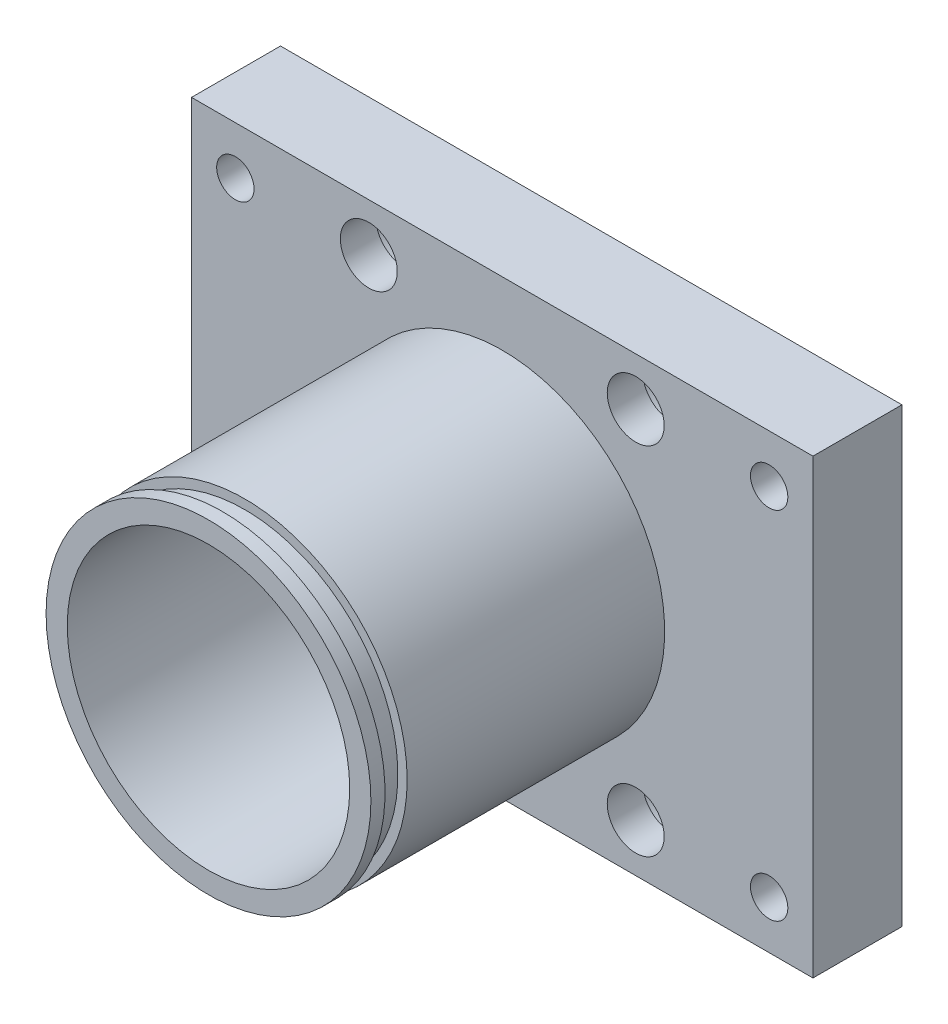
from build123d import *

# Parameters (mm, degrees)
SKETCH1_W                      = 69.85
SKETCH1_H                      = 50.8
BOSS_EXTRUDE1_DEPTH            = 10
SKETCH2_R                      = 15.875
CUT_EXTRUDE1_DEPTH             = 45.327368803
M5X0_8_TAPPED_HOLE1_D          = 4.2
CBORE_FOR_M6_SHCS1_D           = 6.4
CBORE_FOR_M6_SHCS1_CBORE_D     = 10.1
CBORE_FOR_M6_SHCS1_CBORE_DEPTH = 6
MIRROR2_COPY_1_D               = 4.2
MIRROR2_COPY_2_D               = 6.4
MIRROR2_COPY_2_CBORE_D         = 10.1
MIRROR2_COPY_2_CBORE_DEPTH     = 6
BOSS_EXTRUDE2_START            = 33.02
SKETCH7_R                      = 18.25625
SKETCH7_R_2                    = 15.875
BOSS_EXTRUDE2_DEPTH            = 33.02
SKETCH8_R                      = 18.85315
SKETCH8_R_2                    = 16.66875
CUT_EXTRUDE2_DEPTH             = 1.3208
SKETCH9_W                      = 2.4892
SKETCH9_H                      = 1.2954


with BuildPart() as part:
    # Sketch1 → Boss-Extrude1 (new body)
    with BuildSketch(Plane.XY):
        Rectangle(SKETCH1_W, SKETCH1_H)
    extrude(amount=BOSS_EXTRUDE1_DEPTH)

    # Sketch2 → Cut-Extrude1 (cut, through all)
    with BuildSketch(Plane.XY.offset(10)):
        Circle(SKETCH2_R)
    extrude(amount=-CUT_EXTRUDE1_DEPTH, mode=Mode.SUBTRACT)

    # M5x0.8 Tapped Hole1 (through all)
    with Locations(Plane.XY.offset(10)):
        with Locations((30, 19.999999878)):
            m5x0_8_tapped_hole1 = Hole(M5X0_8_TAPPED_HOLE1_D / 2)

    # CBORE for M6 SHCS1 (through all)
    with Locations(Plane(origin=(0, 0, 0), x_dir=(-1, 0, 0), z_dir=(0, 0, -1))):
        with Locations((-15, 20)):
            cbore_for_m6_shcs1 = CounterBoreHole(CBORE_FOR_M6_SHCS1_D / 2, CBORE_FOR_M6_SHCS1_CBORE_D / 2, CBORE_FOR_M6_SHCS1_CBORE_DEPTH)

    # Mirror1: M5x0.8 Tapped Hole1, CBORE for M6 SHCS1 across plane
    add(m5x0_8_tapped_hole1.mirror(Plane.ZX), mode=Mode.SUBTRACT)
    add(cbore_for_m6_shcs1.mirror(Plane.ZX), mode=Mode.SUBTRACT)

    # Mirror2: M5x0.8 Tapped Hole1, CBORE for M6 SHCS1 across plane
    add(m5x0_8_tapped_hole1.mirror(Plane(origin=(0, 0, 0), x_dir=(0, 0, 1), z_dir=(1, 0, 0))), mode=Mode.SUBTRACT)
    add(cbore_for_m6_shcs1.mirror(Plane(origin=(0, 0, 0), x_dir=(0, 0, 1), z_dir=(1, 0, 0))), mode=Mode.SUBTRACT)

    # Mirror2 copy 1 (through all)
    with Locations(Plane(origin=(0, 0, 10), x_dir=(-1, 0, 0), z_dir=(0, 0, 1))):
        with Locations((30, 19.999999878)):
            Hole(MIRROR2_COPY_1_D / 2)

    # Mirror2 copy 2 (through all)
    with Locations(Plane(origin=(0, 0, 0), x_dir=(1, 0, 0), z_dir=(0, 0, -1))):
        with Locations((-15, 20)):
            CounterBoreHole(MIRROR2_COPY_2_D / 2, MIRROR2_COPY_2_CBORE_D / 2, MIRROR2_COPY_2_CBORE_DEPTH)

    # Sketch7 → Boss-Extrude2 (add)
    with BuildSketch(Plane.XY.offset(10).offset(BOSS_EXTRUDE2_START)):
        with Locations(Location((0, 0, 0), (0, 0, 180))):
            Circle(SKETCH7_R)
        Circle(SKETCH7_R_2, mode=Mode.SUBTRACT)
    extrude(amount=-BOSS_EXTRUDE2_DEPTH)

    # Sketch8 → Cut-Extrude2 (cut)
    with BuildSketch(Plane(origin=(0, 0, 0), x_dir=(-1, 0, 0), z_dir=(0, 0, -1))):
        Circle(SKETCH8_R)
        Circle(SKETCH8_R_2, mode=Mode.SUBTRACT)
    extrude(amount=-CUT_EXTRUDE2_DEPTH, mode=Mode.SUBTRACT)

    # Sketch9 → Cut-Revolve1 (revolve, cut)
    with BuildSketch(Plane(origin=(0, 0, 0), x_dir=(0, 0, -1), z_dir=(1, 0, 0)), mode=Mode.PRIVATE) as cut_revolve1_sk:
        with Locations((-40.1879, -17.85874)):
            Rectangle(SKETCH9_W, SKETCH9_H)
    revolve(cut_revolve1_sk.sketch.rotate(Axis((0, 0, -4.391211434), (0, 0, 1)), 270), axis=Axis((0, 0, -4.391211434), (0, 0, 1)), mode=Mode.SUBTRACT)


solid = part.part
